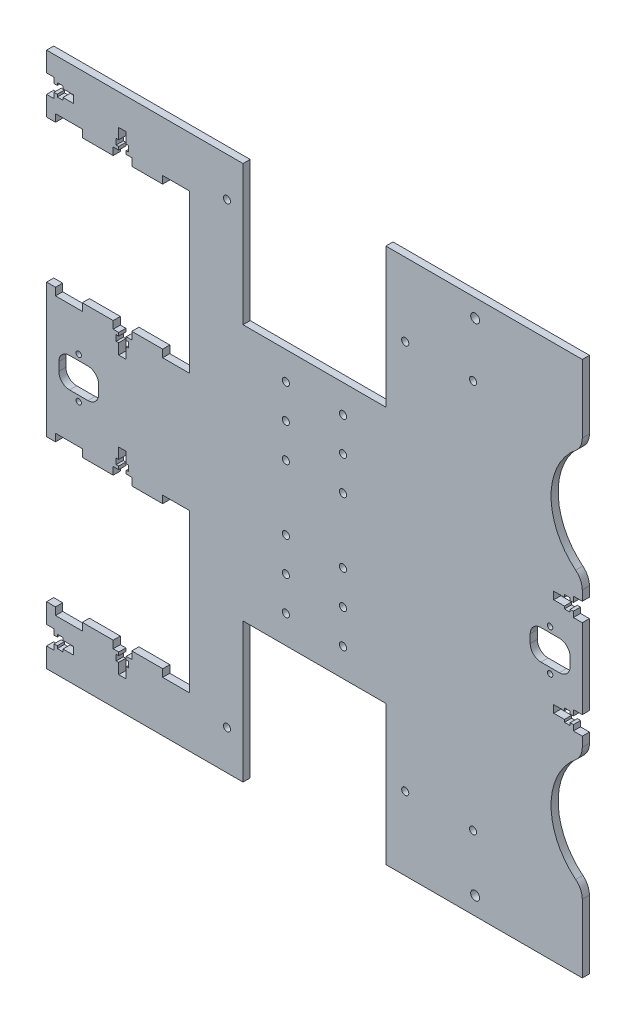
from build123d import *

# Parameters (mm, degrees)
ESQUISSE1_W                  = 300
ESQUISSE1_H                  = 300
BOSS_EXTRU_1_DEPTH           = 2
ESQUISSE2_R                  = 2
ESQUISSE2_W                  = 80
ESQUISSE2_H                  = 78.17
ENL_V_MAT_EXTRU_1_DEPTH      = 213.169743366
ESQUISSE3_R                  = 37.5
ENL_V_MAT_EXTRU_2_DEPTH      = 213.169743366
ENL_V_MAT_EXTRU_3_DEPTH      = 213.169743366
ENL_V_MAT_EXTRU_3_DEPTH_BACK = 213.169743366
ESQUISSE4_W                  = 80
ESQUISSE4_H                  = 80
ESQUISSE7_R                  = 2
ENL_V_MAT_EXTRU_6_DEPTH      = 213.169743366
ESQUISSE8_R                  = 2.5
ENL_V_MAT_EXTRU_7_DEPTH      = 213.169743366
CONG_1_R                     = 10
ESQUISSE12_W                 = 4.4
ESQUISSE12_H                 = 10.4
ENL_V_MAT_EXTRU_11_DEPTH     = 213.169743366
ENL_V_MAT_EXTRU_12_DEPTH     = 213.169743366
ESQUISSE14_R                 = 1.5
ENL_V_MAT_EXTRU_13_DEPTH     = 213.169743366
ESQUISSE15_W                 = 4.4
ESQUISSE15_H                 = 10.4
ENL_V_MAT_EXTRU_14_DEPTH     = 5
ENL_V_MAT_EXTRU_15_DEPTH     = 213.169743366
ESQUISSE17_W                 = 15
ESQUISSE17_H                 = 4.2
ESQUISSE17_W_2               = 10.4
ESQUISSE17_H_2               = 4.4
ENL_V_MAT_EXTRU_16_DEPTH     = 213.169743366
ENL_V_MAT_EXTRU_17_DEPTH     = 213.169743366


with BuildPart() as part:
    # Esquisse1 → Boss.-Extru.1 (new, symmetric)
    with BuildSketch(Plane.XY):
        Rectangle(ESQUISSE1_W, ESQUISSE1_H)
    extrude(amount=BOSS_EXTRU_1_DEPTH, both=True)

    # Esquisse2 → Enlèv. mat.-Extru.1 (cut, through all)
    with BuildSketch(Plane.XY.offset(2)):
        with Locations((16, -18.13)):
            Circle(ESQUISSE2_R)
        with Locations((16, -37.13)):
            Circle(ESQUISSE2_R)
        with Locations((16, -56.13)):
            Circle(ESQUISSE2_R)
        with Locations((-16, -56.13)):
            Circle(ESQUISSE2_R)
        with Locations((-16, -37.13)):
            Circle(ESQUISSE2_R)
        with Locations((-16, -18.13)):
            Circle(ESQUISSE2_R)
        with Locations((50.842036053, -109.03)):
            Circle(ESQUISSE2_R)
        with Locations((88.842036053, -109.03)):
            Circle(ESQUISSE2_R)
        with Locations(Location((88.842036053, 109.03, 0), (0, 0, 180))):
            Circle(ESQUISSE2_R)
        with Locations(Location((50.842036053, 109.03, 0), (0, 0, 180))):
            Circle(ESQUISSE2_R)
        with Locations(Location((-16, 18.13, 0), (0, 0, 180))):
            Circle(ESQUISSE2_R)
        with Locations(Location((-16, 37.13, 0), (0, 0, 180))):
            Circle(ESQUISSE2_R)
        with Locations(Location((-16, 56.13, 0), (0, 0, 180))):
            Circle(ESQUISSE2_R)
        with Locations(Location((16, 56.13, 0), (0, 0, 180))):
            Circle(ESQUISSE2_R)
        with Locations(Location((16, 37.13, 0), (0, 0, 180))):
            Circle(ESQUISSE2_R)
        with Locations(Location((16, 18.13, 0), (0, 0, 180))):
            Circle(ESQUISSE2_R)
        with Locations((0, -110.915)):
            Rectangle(ESQUISSE2_W, ESQUISSE2_H)
        with Locations((0, 110.915)):
            Rectangle(ESQUISSE2_W, ESQUISSE2_H)
    extrude(amount=-ENL_V_MAT_EXTRU_1_DEPTH, mode=Mode.SUBTRACT)

    # Esquisse3 → Enlèv. mat.-Extru.2 (cut, through all)
    with BuildSketch(Plane.XY.offset(2)):
        with Locations((170, -75)):
            Circle(ESQUISSE3_R)
        with Locations((170, 75)):
            Circle(ESQUISSE3_R)
    extrude(amount=-ENL_V_MAT_EXTRU_2_DEPTH, mode=Mode.SUBTRACT)

    # Esquisse4 → Enlèv. mat.-Extru.3 (cut, two sides: drawn at the far end of the back side and taken through both)
    with BuildSketch(Plane.XY.offset(2).offset(-ENL_V_MAT_EXTRU_3_DEPTH_BACK)):
        with Locations((-110, 77.5)):
            Rectangle(ESQUISSE4_W, ESQUISSE4_H)
        with Locations((-110, -77.5)):
            Rectangle(ESQUISSE4_W, ESQUISSE4_H)
    extrude(amount=ENL_V_MAT_EXTRU_3_DEPTH + ENL_V_MAT_EXTRU_3_DEPTH_BACK, mode=Mode.SUBTRACT)

    # Esquisse7 → Enlèv. mat.-Extru.6 (cut, through all)
    with BuildSketch(Plane.XY.offset(2)):
        with Locations((-49, -128.03)):
            Circle(ESQUISSE7_R)
        with Locations(Location((-49, 128.03, 0), (0, 0, 180))):
            Circle(ESQUISSE7_R)
    extrude(amount=-ENL_V_MAT_EXTRU_6_DEPTH, mode=Mode.SUBTRACT)

    # Esquisse8 → Enlèv. mat.-Extru.7 (cut, through all)
    with BuildSketch(Plane.XY.offset(2)):
        with Locations((90, -140)):
            Circle(ESQUISSE8_R)
        with Locations(Location((90, 140, 0), (0, 0, 180))):
            Circle(ESQUISSE8_R)
    extrude(amount=-ENL_V_MAT_EXTRU_7_DEPTH, mode=Mode.SUBTRACT)

    # Congé1
    cong_1_edges = [part.edges().sort_by_distance(p)[0] for p in [
        (150, -106.721443851, 0),
        (150, -43.278556149, 0),
        (150, 43.278556149, 0),
        (150, 106.721443851, 0),
    ]]
    fillet(cong_1_edges, radius=CONG_1_R)

    # Esquisse12 → Enlèv. mat.-Extru.11 (cut, through all)
    with BuildSketch(Plane(origin=(0, 0, -2), x_dir=(-1, 0, 0), z_dir=(0, 0, -1))):
        with Locations((148, 133.75)):
            Rectangle(ESQUISSE12_W, ESQUISSE12_H)
        with Locations((148, -133.75)):
            Rectangle(ESQUISSE12_W, ESQUISSE12_H)
    extrude(amount=-ENL_V_MAT_EXTRU_11_DEPTH, mode=Mode.SUBTRACT)

    # Esquisse13 → Enlèv. mat.-Extru.12 (cut, through all)
    with BuildSketch(Plane(origin=(0, 0, -2), x_dir=(-1, 0, 0), z_dir=(0, 0, -1))):
        Polygon((134.8, 131.65), (134.8, 135.85), (140.8, 135.85), (140.8, 137.25), (144, 137.25), (144, 135.85), (145.8, 135.85), (145.8, 131.65), (144, 131.65), (144, 130.25), (140.8, 130.25), (140.8, 131.65), align=None)
        Polygon((134.8, -131.65), (140.8, -131.65), (140.8, -130.25), (144, -130.25), (144, -131.65), (145.8, -131.65), (145.8, -135.85), (144, -135.85), (144, -137.25), (140.8, -137.25), (140.8, -135.85), (134.8, -135.85), align=None)
    extrude(amount=-ENL_V_MAT_EXTRU_12_DEPTH, mode=Mode.SUBTRACT)

    # Esquisse14 → Enlèv. mat.-Extru.13 (cut, through all)
    with BuildSketch(Plane(origin=(0, 0, -2), x_dir=(-1, 0, 0), z_dir=(0, 0, -1))):
        with Locations((-132, -11.5)):
            Circle(ESQUISSE14_R)
        with Locations((-132, 11.5)):
            Circle(ESQUISSE14_R)
        with Locations(Location((132, 11.5, 0), (0, 0, 180))):
            Circle(ESQUISSE14_R)
        with Locations(Location((132, -11.5, 0), (0, 0, 180))):
            Circle(ESQUISSE14_R)
        with BuildLine():
            Line((-137.159, 8.366), (-126.839, 8.366))
            ThreePointArc((-126.839, 8.366), (-122.596359313, 6.608640687), (-120.839, 2.366))
            Line((-120.839, 2.366), (-120.839, -2.366))
            ThreePointArc((-120.839, -2.366), (-122.596359313, -6.608640687), (-126.839, -8.366))
            Line((-126.839, -8.366), (-137.159, -8.366))
            ThreePointArc((-137.159, -8.366), (-141.401640687, -6.608640687), (-143.159, -2.366))
            Line((-143.159, -2.366), (-143.159, 2.366))
            ThreePointArc((-143.159, 2.366), (-141.401640687, 6.608640687), (-137.159, 8.366))
        make_face()
        with BuildLine():
            Line((143.159, 2.366), (143.159, -2.366))
            ThreePointArc((143.159, -2.366), (141.401640687, -6.608640687), (137.159, -8.366))
            Line((137.159, -8.366), (126.839, -8.366))
            ThreePointArc((126.839, -8.366), (122.596359313, -6.608640687), (120.839, -2.366))
            Line((120.839, -2.366), (120.839, 2.366))
            ThreePointArc((120.839, 2.366), (122.596359313, 6.608640687), (126.839, 8.366))
            Line((126.839, 8.366), (137.159, 8.366))
            ThreePointArc((137.159, 8.366), (141.401640687, 6.608640687), (143.159, 2.366))
        make_face()
    extrude(amount=-ENL_V_MAT_EXTRU_13_DEPTH, mode=Mode.SUBTRACT)

    # Esquisse15 → Enlèv. mat.-Extru.14 (cut)
    with BuildSketch(Plane(origin=(150, 0, 0), x_dir=(0, 0, -1), z_dir=(1, 0, 0))):
        with Locations((0, -27.5)):
            Rectangle(ESQUISSE15_W, ESQUISSE15_H)
        with Locations((0, 27.5)):
            Rectangle(ESQUISSE15_W, ESQUISSE15_H)
    extrude(amount=-ENL_V_MAT_EXTRU_14_DEPTH, mode=Mode.SUBTRACT)

    # Esquisse16 → Enlèv. mat.-Extru.15 (cut, through all)
    with BuildSketch(Plane(origin=(0, 0, -2), x_dir=(-1, 0, 0), z_dir=(0, 0, -1))):
        Polygon((-145, -29.6), (-145, -25.4), (-143.2, -25.4), (-143.2, -24), (-140, -24), (-140, -25.4), (-134, -25.4), (-134, -29.6), (-140, -29.6), (-140, -31), (-143.2, -31), (-143.2, -29.6), align=None)
        Polygon((-145, 29.6), (-143.2, 29.6), (-143.2, 31), (-140, 31), (-140, 29.6), (-134, 29.6), (-134, 25.4), (-140, 25.4), (-140, 24), (-143.2, 24), (-143.2, 25.4), (-145, 25.4), align=None)
    extrude(amount=-ENL_V_MAT_EXTRU_15_DEPTH, mode=Mode.SUBTRACT)

    # Esquisse17 → Enlèv. mat.-Extru.16 (cut, through all)
    with BuildSketch(Plane(origin=(0, 0, -2), x_dir=(-1, 0, 0), z_dir=(0, 0, -1))):
        with Locations((137.5, 119.6)):
            Rectangle(ESQUISSE17_W, ESQUISSE17_H)
        with Locations((107.5, 119.5)):
            Rectangle(ESQUISSE17_W_2, ESQUISSE17_H_2)
        with Locations((77.5, 119.6)):
            Rectangle(ESQUISSE17_W, ESQUISSE17_H)
        with Locations((77.5, 35.4)):
            Rectangle(ESQUISSE17_W, ESQUISSE17_H)
        with Locations((107.5, 35.5)):
            Rectangle(ESQUISSE17_W_2, ESQUISSE17_H_2)
        with Locations((137.5, 35.4)):
            Rectangle(ESQUISSE17_W, ESQUISSE17_H)
        with Locations((137.5, -35.4)):
            Rectangle(ESQUISSE17_W, ESQUISSE17_H)
        with Locations((107.5, -35.5)):
            Rectangle(ESQUISSE17_W_2, ESQUISSE17_H_2)
        with Locations((77.5, -35.4)):
            Rectangle(ESQUISSE17_W, ESQUISSE17_H)
        with Locations((77.5, -119.6)):
            Rectangle(ESQUISSE17_W, ESQUISSE17_H)
        with Locations((107.5, -119.5)):
            Rectangle(ESQUISSE17_W_2, ESQUISSE17_H_2)
        with Locations((137.5, -119.6)):
            Rectangle(ESQUISSE17_W, ESQUISSE17_H)
    extrude(amount=-ENL_V_MAT_EXTRU_16_DEPTH, mode=Mode.SUBTRACT)

    # Esquisse18 → Enlèv. mat.-Extru.17 (cut, through all)
    with BuildSketch(Plane.XY.offset(2)):
        Polygon((-105.4, 121.7), (-109.6, 121.7), (-109.6, 123.5), (-111, 123.5), (-111, 126.7), (-109.6, 126.7), (-109.6, 132.7), (-105.4, 132.7), (-105.4, 126.7), (-104, 126.7), (-104, 123.5), (-105.4, 123.5), align=None)
        Polygon((-105.4, 33.3), (-105.4, 31.5), (-104, 31.5), (-104, 28.3), (-105.4, 28.3), (-105.4, 22.3), (-109.6, 22.3), (-109.6, 28.3), (-111, 28.3), (-111, 31.5), (-109.6, 31.5), (-109.6, 33.3), align=None)
        Polygon((-105.4, -33.3), (-109.6, -33.3), (-109.6, -31.5), (-111, -31.5), (-111, -28.3), (-109.6, -28.3), (-109.6, -22.3), (-105.4, -22.3), (-105.4, -28.3), (-104, -28.3), (-104, -31.5), (-105.4, -31.5), align=None)
        Polygon((-105.4, -121.7), (-105.4, -123.5), (-104, -123.5), (-104, -126.7), (-105.4, -126.7), (-105.4, -132.7), (-109.6, -132.7), (-109.6, -126.7), (-111, -126.7), (-111, -123.5), (-109.6, -123.5), (-109.6, -121.7), align=None)
    extrude(amount=-ENL_V_MAT_EXTRU_17_DEPTH, mode=Mode.SUBTRACT)


solid = part.part
